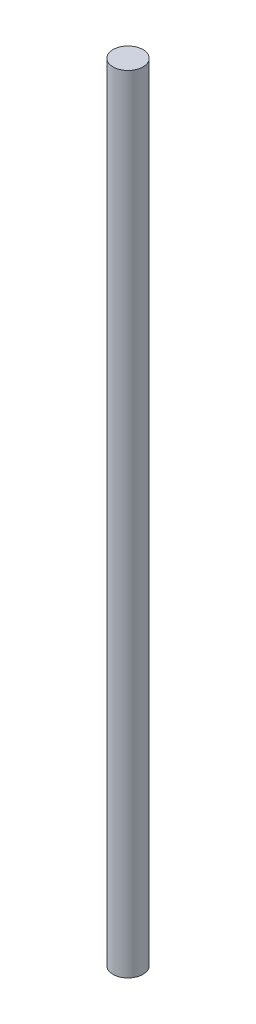
from build123d import *

# Parameters (mm, degrees)
SKETCH1_R           = 2.9083
BOSS_EXTRUDE1_DEPTH = 152.4


with BuildPart() as part:
    # Sketch1 → Boss-Extrude1 (new body)
    with BuildSketch(Plane(origin=(0, 0, 0), x_dir=(1, 0, 0), z_dir=(0, 1, 0))):
        with Locations(Location((0, 0, 0), (0, 0, 90))):
            Circle(SKETCH1_R)
    extrude(amount=BOSS_EXTRUDE1_DEPTH)


solid = part.part
